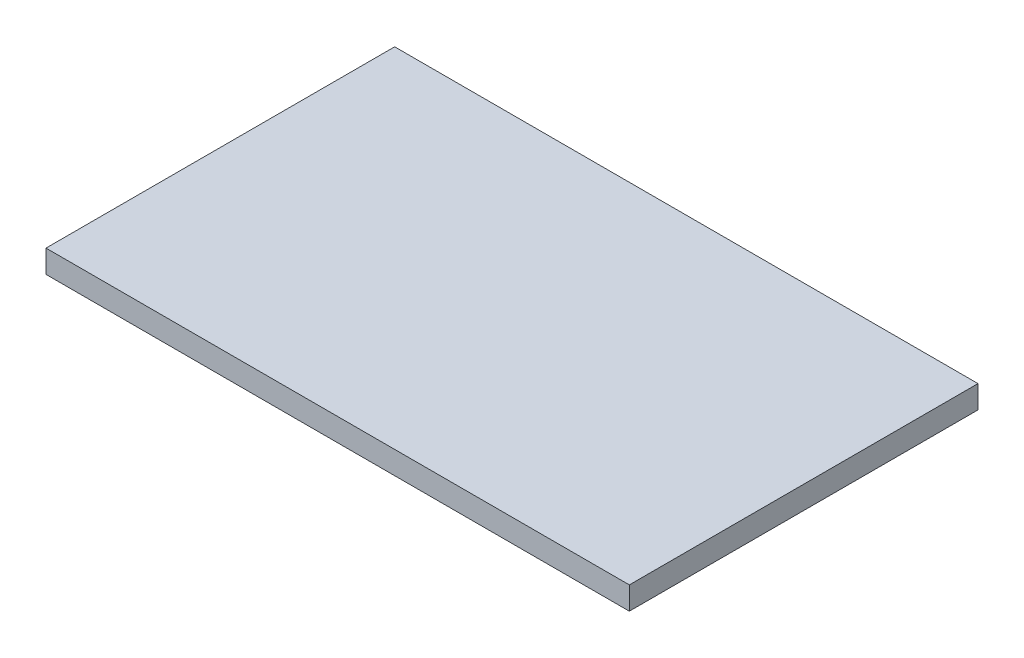
from build123d import *

# Parameters (mm, degrees)
ESQUISSE1_W        = 51.151406423
ESQUISSE1_H        = 30.573254414
BOSS_EXTRU_1_DEPTH = 2


with BuildPart() as part:
    # Esquisse1 → Boss.-Extru.1 (new body)
    with BuildSketch(Plane(origin=(0, 0, 0), x_dir=(1, 0, 0), z_dir=(0, 1, 0))):
        with Locations((25.575703212, 15.286627207)):
            Rectangle(ESQUISSE1_W, ESQUISSE1_H)
    extrude(amount=BOSS_EXTRU_1_DEPTH)


solid = part.part
